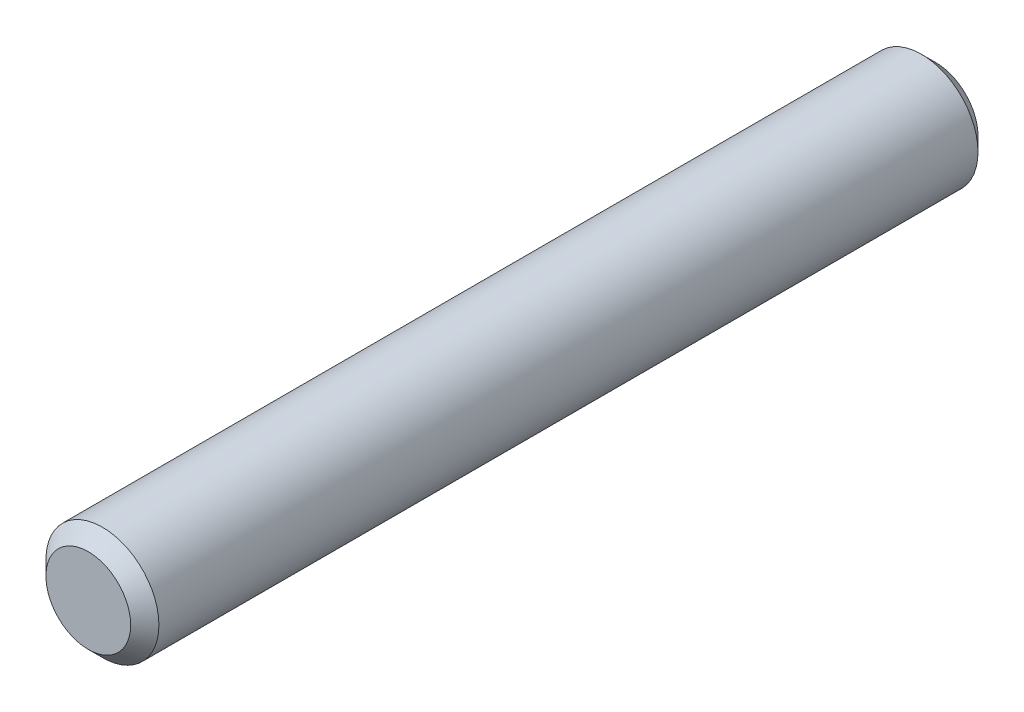
from build123d import *

# Parameters (mm, degrees)
SKETCH1_R           = 2
BOSS_EXTRUDE1_DEPTH = 30
CHAMFER1_SIZE       = 0.5
CHAMFER2_SIZE       = 0.5


with BuildPart() as part:
    # Sketch1 → Boss-Extrude1 (new body)
    with BuildSketch(Plane.XY):
        Circle(SKETCH1_R)
    extrude(amount=BOSS_EXTRUDE1_DEPTH)

    # Chamfer1
    chamfer1_edges = [part.edges().sort_by_distance(p)[0] for p in [
        (-2, 0, 0),
    ]]
    chamfer(chamfer1_edges, length=CHAMFER1_SIZE)

    # Chamfer2
    chamfer2_edges = [part.edges().sort_by_distance(p)[0] for p in [
        (-2, 0, 30),
    ]]
    chamfer(chamfer2_edges, length=CHAMFER2_SIZE)


solid = part.part
